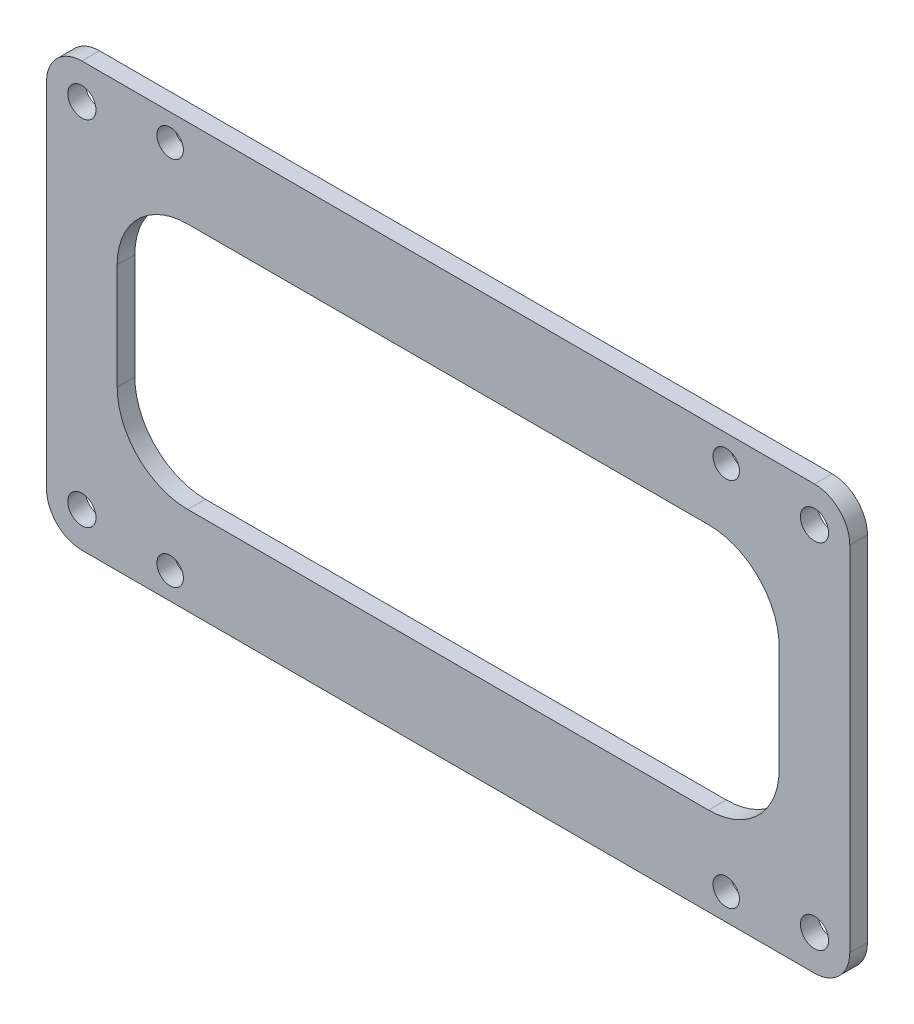
from build123d import *

# Parameters (mm, degrees)
SKETCH_1_R      = 1.5
SKETCH_1_R_2    = 1.6
EXTRUDE_1_DEPTH = 2


with BuildPart() as part:
    # 草图1 → 凸台-拉伸1 (new body)
    with BuildSketch(Plane.XY):
        with BuildLine():
            Line((41.5, -24), (-41.5, -24))
            ThreePointArc((-41.5, -24), (-44.328427125, -22.828427125), (-45.5, -20))
            Line((-45.5, -20), (-45.5, 20))
            ThreePointArc((-45.5, 20), (-44.328427125, 22.828427125), (-41.5, 24))
            Line((-41.5, 24), (41.5, 24))
            ThreePointArc((41.5, 24), (44.328427125, 22.828427125), (45.5, 20))
            Line((45.5, 20), (45.5, -20))
            ThreePointArc((45.5, -20), (44.328427125, -22.828427125), (41.5, -24))
        make_face()
        with Locations((-31.5, 21)):
            Circle(SKETCH_1_R, mode=Mode.SUBTRACT)
        with Locations((31.5, 21)):
            Circle(SKETCH_1_R, mode=Mode.SUBTRACT)
        with Locations((31.5, -21)):
            Circle(SKETCH_1_R, mode=Mode.SUBTRACT)
        with Locations((-31.5, -21)):
            Circle(SKETCH_1_R, mode=Mode.SUBTRACT)
        with Locations((-41.5, 20)):
            Circle(SKETCH_1_R_2, mode=Mode.SUBTRACT)
        with Locations((-41.5, -20)):
            Circle(SKETCH_1_R_2, mode=Mode.SUBTRACT)
        with Locations((41.5, 20)):
            Circle(SKETCH_1_R_2, mode=Mode.SUBTRACT)
        with Locations((41.5, -20)):
            Circle(SKETCH_1_R_2, mode=Mode.SUBTRACT)
        with BuildLine():
            Line((29.5, -14), (-29.5, -14))
            ThreePointArc((-29.5, -14), (-35.156854249, -11.656854249), (-37.5, -6))
            Line((-37.5, -6), (-37.5, 6))
            ThreePointArc((-37.5, 6), (-35.156854249, 11.656854249), (-29.5, 14))
            Line((-29.5, 14), (29.5, 14))
            ThreePointArc((29.5, 14), (35.156854249, 11.656854249), (37.5, 6))
            Line((37.5, 6), (37.5, -6))
            ThreePointArc((37.5, -6), (35.156854249, -11.656854249), (29.5, -14))
        make_face(mode=Mode.SUBTRACT)
    extrude(amount=EXTRUDE_1_DEPTH)


solid = part.part
